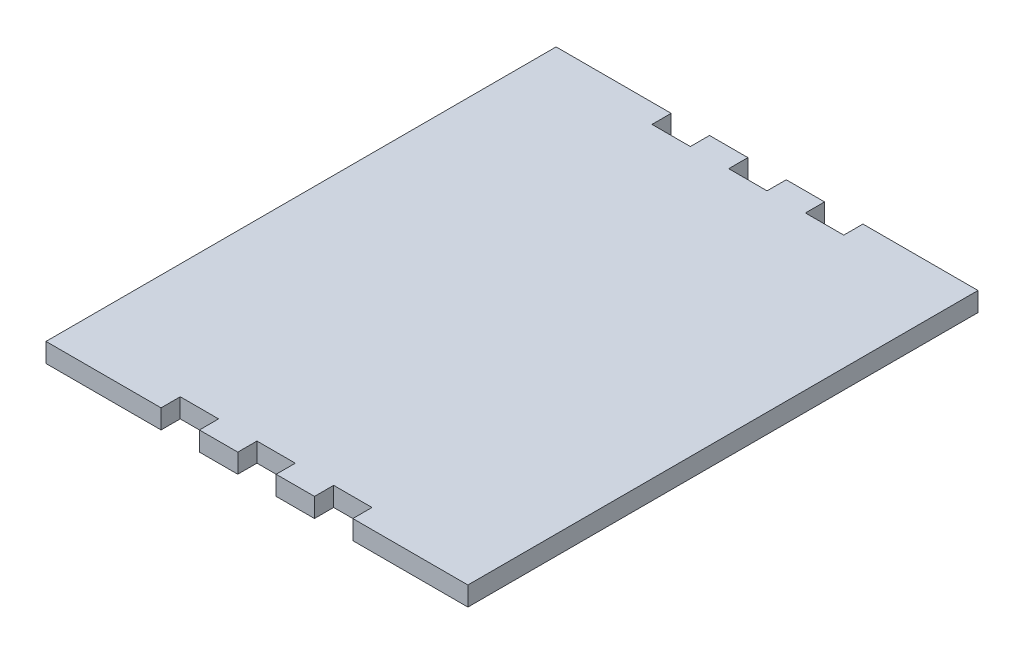
from build123d import *

# Parameters (mm, degrees)
BOSS_EXTRUDE1_DEPTH = 3.175


with BuildPart() as part:
    # Sketch1 → Boss-Extrude1 (new body)
    with BuildSketch(Plane(origin=(0, 0, 0), x_dir=(1, 0, 0), z_dir=(0, 1, 0))):
        Polygon((-34.925, -42.2275), (-15.875, -42.2275), (-15.875, -39.0525), (-9.525, -39.0525), (-9.525, -42.2275), (-3.175, -42.2275), (-3.175, -39.0525), (3.175, -39.0525), (3.175, -42.2275), (9.525, -42.2275), (9.525, -39.0525), (15.875, -39.0525), (15.875, -42.2275), (34.925, -42.2275), (34.925, 42.2275), (15.875, 42.2275), (15.875, 39.0525), (9.525, 39.0525), (9.525, 42.2275), (3.175, 42.2275), (3.175, 39.0525), (-3.175, 39.0525), (-3.175, 42.2275), (-9.525, 42.2275), (-9.525, 39.0525), (-15.875, 39.0525), (-15.875, 42.2275), (-34.925, 42.2275), align=None)
    extrude(amount=BOSS_EXTRUDE1_DEPTH)


solid = part.part
